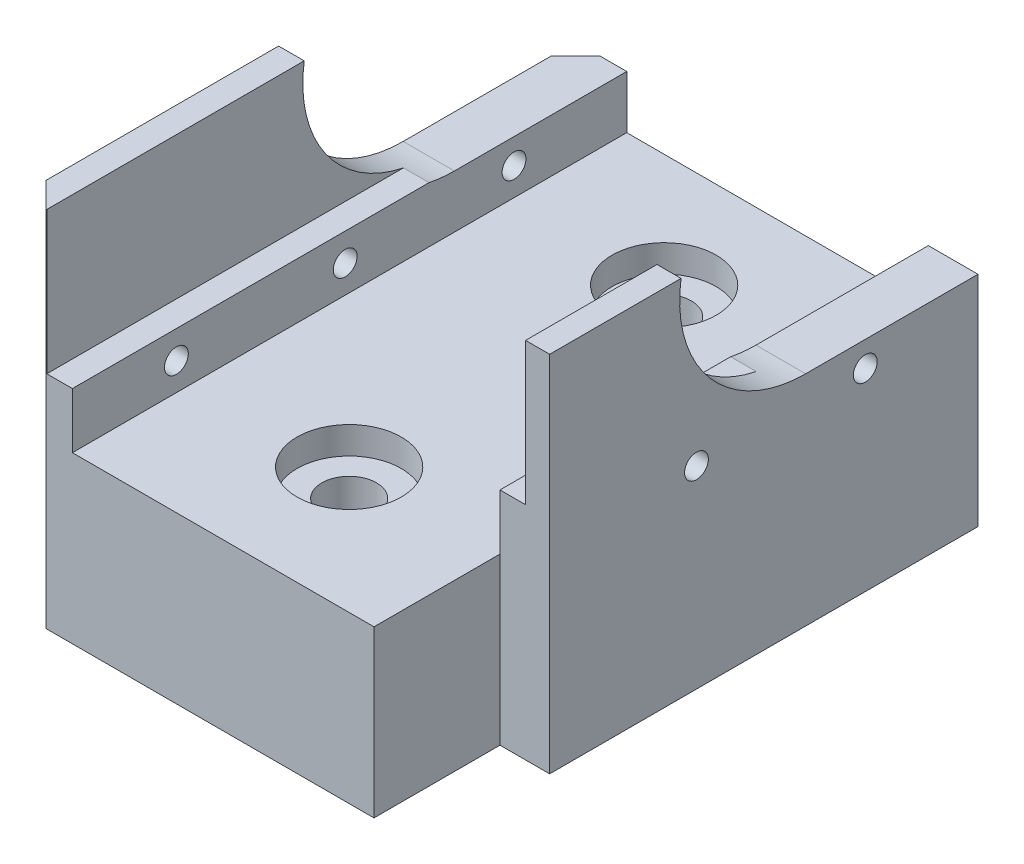
from build123d import *

# Parameters (mm, degrees)
SKETCH1_W                       = 45.72
SKETCH1_H                       = 60.96
BOSS_EXTRUDE1_DEPTH             = 6.35
SKETCH2_W                       = 7.6600046
SKETCH2_H                       = 60.96
BOSS_EXTRUDE2_DEPTH             = 20.955
LPATTERN1_COUNT                 = 3
LPATTERN1_PITCH                 = 17.018
SKETCH1_3_W                     = 45.72
SKETCH1_3_H                     = 60.96
BOSS_EXTRUDE3_DEPTH             = 2.54
CUT_EXTRUDE1_START              = 15.199995
SKETCH11_W                      = 60.96
SKETCH11_H                      = 14.3449802
CUT_EXTRUDE1_DEPTH              = 17.78
CUT_EXTRUDE2_DEPTH              = 62.358877312
SKETCH17_W                      = 45.72
SKETCH17_H                      = 60.96
BOSS_EXTRUDE4_DEPTH             = 6.785
SKETCH19_W                      = 30.3999908
SKETCH19_H                      = 60.96
BOSS_EXTRUDE5_DEPTH             = 1.0100056
CBORE_FOR_M5_SBHCS2_D           = 5.5
CBORE_FOR_M5_SBHCS2_CBORE_D     = 10.5
CBORE_FOR_M5_SBHCS2_CBORE_DEPTH = 2.75
CUT_EXTRUDE3_DEPTH              = 82.222264916
CUT_EXTRUDE3_DEPTH_BACK         = 82.222264916
SKETCH24_W                      = 5.08
SKETCH24_H                      = 45.72
SKETCH25_W                      = 7.6600046
SKETCH25_H                      = 36.63
CUT_EXTRUDE4_DEPTH              = 12.7
SKETCH26_W                      = 2.400000026
SKETCH26_H                      = 36.63
CUT_EXTRUDE5_DEPTH              = 67.262485805
SKETCH27_W                      = 2.5
SKETCH27_H                      = 36.63
CUT_EXTRUDE6_DEPTH              = 67.262485805
CHAMFER1_SIZE                   = 2.5
SKETCH28_W                      = 0.254
SKETCH28_H                      = 36.63
CUT_EXTRUDE7_DEPTH              = 66.473269538


with BuildPart() as part:
    # Sketch1 → Boss-Extrude1 (new body)
    with BuildSketch(Plane(origin=(0, 0, 0), x_dir=(1, 0, 0), z_dir=(0, 1, 0))):
        Rectangle(SKETCH1_W, SKETCH1_H)
    extrude(amount=BOSS_EXTRUDE1_DEPTH)

    # Sketch2 → Boss-Extrude2 (add)
    with BuildSketch(Plane(origin=(0, 6.35, 0), x_dir=(1, 0, 0), z_dir=(0, 1, 0))):
        with Locations((-19.0299977, 0)):
            Rectangle(SKETCH2_W, SKETCH2_H)
        with Locations((19.0299977, 0)):
            Rectangle(SKETCH2_W, SKETCH2_H)
    extrude(amount=BOSS_EXTRUDE2_DEPTH)

    # Sketch7 → M2 Clearance Hole2 (revolve, cut)
    with BuildSketch(Plane(origin=(22.86, 10.16, 14.9171914), x_dir=(0, 0, -1), z_dir=(0, 1, 0))):
        Polygon((0, 0), (0, 46.441032743), (1.2, 45.72), (1.2, 0), align=None)
    m2_clearance_hole2 = revolve(axis=Axis((29.21, 10.16, 14.9171914), (-1, 0, 0)), mode=Mode.SUBTRACT)

    # LPattern1: M2 Clearance Hole2 ×3
    with Locations(*[(0, 0, -i * LPATTERN1_PITCH) for i in range(1, LPATTERN1_COUNT)]):
        add(m2_clearance_hole2, mode=Mode.SUBTRACT)

    # Sketch1<3> → Boss-Extrude3 (add)
    with BuildSketch(Plane(origin=(0, 0, 0), x_dir=(1, 0, 0), z_dir=(0, 1, 0))):
        Rectangle(SKETCH1_3_W, SKETCH1_3_H)
    extrude(amount=-BOSS_EXTRUDE3_DEPTH)

    # Sketch11 → Cut-Extrude1 (cut, symmetric)
    with BuildSketch(Plane.ZY.offset(-15.1999954).offset(CUT_EXTRUDE1_START)):
        with Locations((0, 20.1325099)):
            Rectangle(SKETCH11_W, SKETCH11_H)
    extrude(amount=CUT_EXTRUDE1_DEPTH, both=True, mode=Mode.SUBTRACT)

    # Sketch12 → Cut-Extrude2 (cut, through all)
    with BuildSketch(Plane(origin=(22.86, 0, 0), x_dir=(0, 0, -1), z_dir=(1, 0, 0))):
        with BuildLine():
            Line((13.105000048, 12.7), (30.48, 12.7))
            Line((30.48, 12.7), (30.48, 27.305))
            Line((30.48, 27.305), (25.661312206, 27.305))
            ThreePointArc((25.661312206, 27.305), (3.474748234, 33.679387055), (13.105000048, 12.7))
        make_face()
    extrude(amount=-CUT_EXTRUDE2_DEPTH, mode=Mode.SUBTRACT)

    # Sketch17 → Boss-Extrude4 (add)
    with BuildSketch(Plane.XZ.offset(2.54)):
        Rectangle(SKETCH17_W, SKETCH17_H)
    extrude(amount=BOSS_EXTRUDE4_DEPTH)

    # Sketch19 → Boss-Extrude5 (add)
    with BuildSketch(Plane(origin=(0, 6.35, 0), x_dir=(1, 0, 0), z_dir=(0, 1, 0))):
        Rectangle(SKETCH19_W, SKETCH19_H)
    extrude(amount=BOSS_EXTRUDE5_DEPTH)

    # CBORE for M5 SBHCS2 (through all)
    with Locations(Plane(origin=(0, 7.3600056, 0), x_dir=(1, 0, 0), z_dir=(0, 1, 0))):
        with Locations((0, -12.7), (0, 19.05)):
            CounterBoreHole(CBORE_FOR_M5_SBHCS2_D / 2, CBORE_FOR_M5_SBHCS2_CBORE_D / 2, CBORE_FOR_M5_SBHCS2_CBORE_DEPTH)

    # Sketch24 → Cut-Extrude3 (cut, two sides: drawn at the far end of the back side and taken through both)
    with BuildSketch(Plane(origin=(31.571183672, -12.7, -14.6188086), x_dir=(0, 0, -1), z_dir=(0, 1, 0)).offset(-CUT_EXTRUDE3_DEPTH_BACK)):
        with Locations((-42.5588086, 31.571183672)):
            Rectangle(SKETCH24_W, SKETCH24_H)
    extrude(amount=CUT_EXTRUDE3_DEPTH + CUT_EXTRUDE3_DEPTH_BACK, mode=Mode.SUBTRACT)

    # Sketch25 → Cut-Extrude4 (cut)
    with BuildSketch(Plane.XY.offset(25.4)):
        with Locations((19.0299977, 8.99)):
            Rectangle(SKETCH25_W, SKETCH25_H)
    extrude(amount=-CUT_EXTRUDE4_DEPTH, mode=Mode.SUBTRACT)

    # Sketch26 → Cut-Extrude5 (cut, through all)
    with BuildSketch(Plane.XY.offset(25.4)):
        with Locations((21.659999987, 8.99)):
            Rectangle(SKETCH26_W, SKETCH26_H)
    extrude(amount=-CUT_EXTRUDE5_DEPTH, mode=Mode.SUBTRACT)

    # Sketch27 → Cut-Extrude6 (cut, through all)
    with BuildSketch(Plane.XY.offset(25.4)):
        with Locations((-21.61, 8.99)):
            Rectangle(SKETCH27_W, SKETCH27_H)
    extrude(amount=-CUT_EXTRUDE6_DEPTH, mode=Mode.SUBTRACT)

    # Chamfer1
    chamfer1_edges = [part.edges().sort_by_distance(p)[0] for p in [
        (-20.36, 1.6875, -30.48),
        (-20.36, 8.99, 25.4),
    ]]
    chamfer(chamfer1_edges, length=CHAMFER1_SIZE)

    # Sketch28 → Cut-Extrude7 (cut, through all)
    with BuildSketch(Plane(origin=(0, 0, -30.48), x_dir=(-1, 0, 0), z_dir=(0, 0, -1))):
        with Locations((-20.332999974, 8.99)):
            Rectangle(SKETCH28_W, SKETCH28_H)
    extrude(amount=-CUT_EXTRUDE7_DEPTH, mode=Mode.SUBTRACT)


solid = part.part
